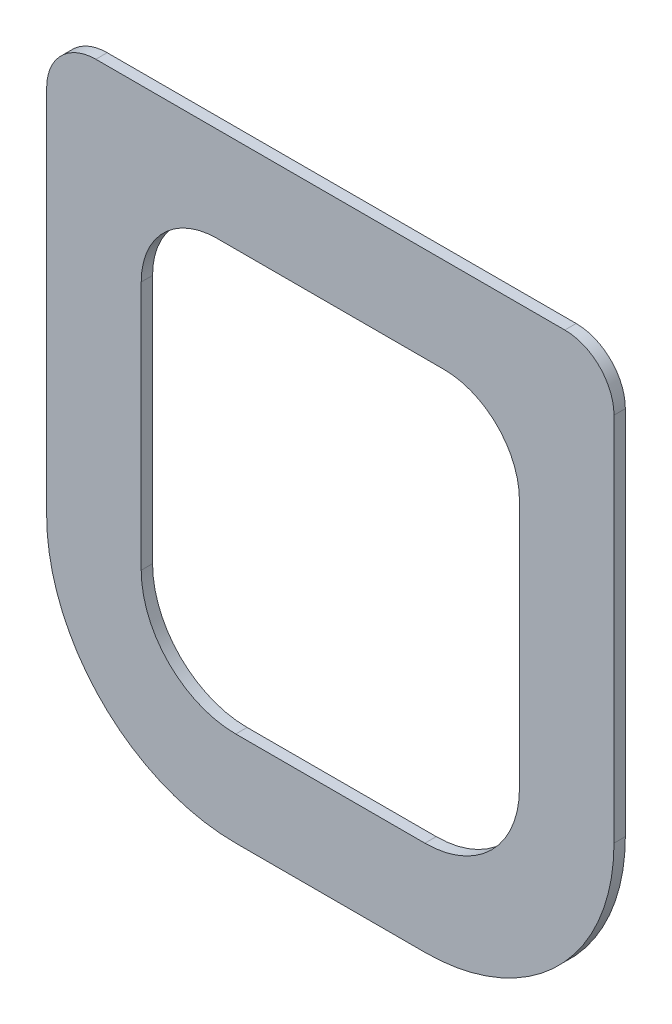
from build123d import *

# Parameters (mm, degrees)
BOSS_EXTRUDE1_DEPTH = 3
FILLET1_R           = 20


with BuildPart() as part:
    # Sketch1 → Boss-Extrude1 (new body)
    with BuildSketch(Plane.XY):
        with BuildLine():
            Line((-0.5, -84.19), (0.5, -84.19))
            Line((0.5, -84.19), (25, -84.19))
            ThreePointArc((25, -84.19), (60.355339059, -69.545339059), (75, -34.19))
            Line((75, -34.19), (75, 63.81))
            ThreePointArc((75, 63.81), (71.192388155, 73.002388155), (62, 76.81))
            Line((62, 76.81), (-62, 76.81))
            ThreePointArc((-62, 76.81), (-71.192388155, 73.002388155), (-75, 63.81))
            Line((-75, 63.81), (-75, -34.19))
            ThreePointArc((-75, -34.19), (-60.355339059, -69.545339059), (-25, -84.19))
            Line((-25, -84.19), (-0.5, -84.19))
        make_face()
        with BuildLine():
            Line((50, 51.81), (-50, 51.81))
            Line((-50, 51.81), (-50, -34.19))
            ThreePointArc((-50, -34.19), (-42.67766953, -51.86766953), (-25, -59.19))
            Line((-25, -59.19), (-0.5, -59.19))
            Line((-0.5, -59.19), (0.5, -59.19))
            Line((0.5, -59.19), (25, -59.19))
            ThreePointArc((25, -59.19), (42.67766953, -51.86766953), (50, -34.19))
            Line((50, -34.19), (50, 51.81))
        make_face(mode=Mode.SUBTRACT)
    extrude(amount=BOSS_EXTRUDE1_DEPTH)

    # Fillet1
    fillet1_edges = [part.edges().sort_by_distance(p)[0] for p in [
        (50, 51.81, 1.5),
        (-50, 51.81, 1.5),
    ]]
    fillet(fillet1_edges, radius=FILLET1_R)


solid = part.part
